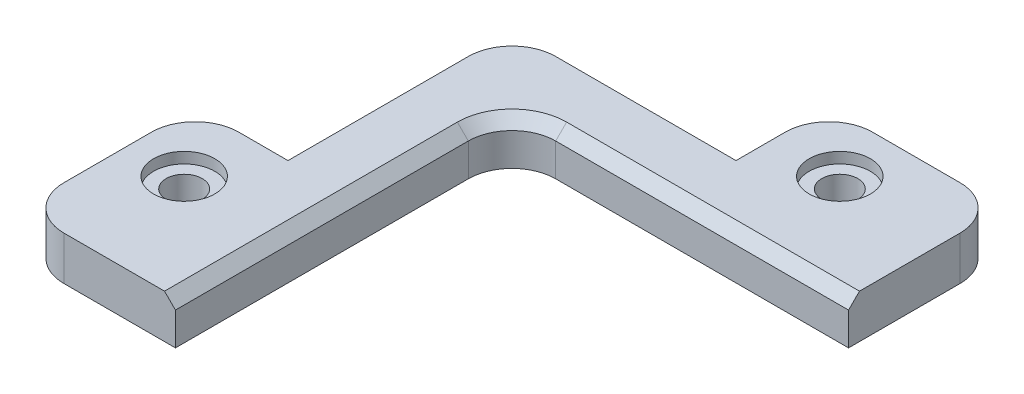
from build123d import *

# Parameters (mm, degrees)
CROQUIS1_R              = 1.65
SALIENTE_EXTRUIR1_DEPTH = 4
CROQUIS2_W              = 30.8
CROQUIS2_H              = 4.2
SALIENTE_EXTRUIR2_DEPTH = 4
CROQUIS3_W              = 8.5
CROQUIS3_H              = 20.5
CORTAR_EXTRUIR1_DEPTH   = 4
REDONDEO1_R             = 4
REDONDEO2_R             = 4
CHAFL_N1_SIZE           = 1
CROQUIS4_R              = 2.8
CORTAR_EXTRUIR2_DEPTH   = 1


with BuildPart() as part:
    # Croquis1 → Saliente-Extruir1 (new body)
    with BuildSketch(Plane(origin=(0, 0, 0), x_dir=(1, 0, 0), z_dir=(0, 1, 0))):
        Polygon((0, 0), (0, 45), (45, 45), (45, 35), (10, 35), (10, 0), align=None)
        with Locations(Location((35, 40, 0), (0, 0, 270))):
            Circle(CROQUIS1_R, mode=Mode.SUBTRACT)
        with Locations(Location((5, 10, 0), (0, 0, 270))):
            Circle(CROQUIS1_R, mode=Mode.SUBTRACT)
    extrude(amount=SALIENTE_EXTRUIR1_DEPTH)

    # Croquis2 → Saliente-Extruir2 (add)
    with BuildSketch(Plane(origin=(0, 4, 0), x_dir=(1, 0, 0), z_dir=(0, 1, 0))):
        with Locations((29.6, 32.9)):
            Rectangle(CROQUIS2_W, CROQUIS2_H)
        Polygon((10, 35), (10, 0), (14.2, 0), (14.2, 30.8), (14.2, 35), align=None)
    extrude(amount=-SALIENTE_EXTRUIR2_DEPTH)

    # Croquis3 → Cortar-Extruir1 (cut)
    with BuildSketch(Plane(origin=(0, 4, 0), x_dir=(1, 0, 0), z_dir=(0, 1, 0))):
        Polygon((29, 45), (0, 45), (0, 36.5), (8.5, 36.5), (29, 36.5), align=None)
        with Locations((4.25, 26.25)):
            Rectangle(CROQUIS3_W, CROQUIS3_H)
    extrude(amount=-CORTAR_EXTRUIR1_DEPTH, mode=Mode.SUBTRACT)

    # Redondeo1
    redondeo1_edges = [part.edges().sort_by_distance(p)[0] for p in [
        (14.2, 2, -30.8),
        (8.5, 2, -36.5),
    ]]
    fillet(redondeo1_edges, radius=REDONDEO1_R)

    # Redondeo2
    redondeo2_edges = [part.edges().sort_by_distance(p)[0] for p in [
        (0, 2, 0),
        (45, 2, -45),
        (0, 2, -16),
        (29, 2, -45),
    ]]
    fillet(redondeo2_edges, radius=REDONDEO2_R)

    # Chaflán1
    chafl_n1_edges = [part.edges().sort_by_distance(p)[0] for p in [
        (31.6, 4, -30.8),
        (14.2, 4, -13.4),
        (15.371572875, 4, -29.628427125),
    ]]
    chamfer(chafl_n1_edges, length=CHAFL_N1_SIZE)

    # Croquis4 → Cortar-Extruir2 (cut)
    with BuildSketch(Plane(origin=(0, 4, 0), x_dir=(1, 0, 0), z_dir=(0, 1, 0))):
        with Locations(Location((35, 40, 0), (0, 0, 270))):
            Circle(CROQUIS4_R)
        with Locations(Location((5, 10, 0), (0, 0, 270))):
            Circle(CROQUIS4_R)
    extrude(amount=-CORTAR_EXTRUIR2_DEPTH, mode=Mode.SUBTRACT)


solid = part.part
